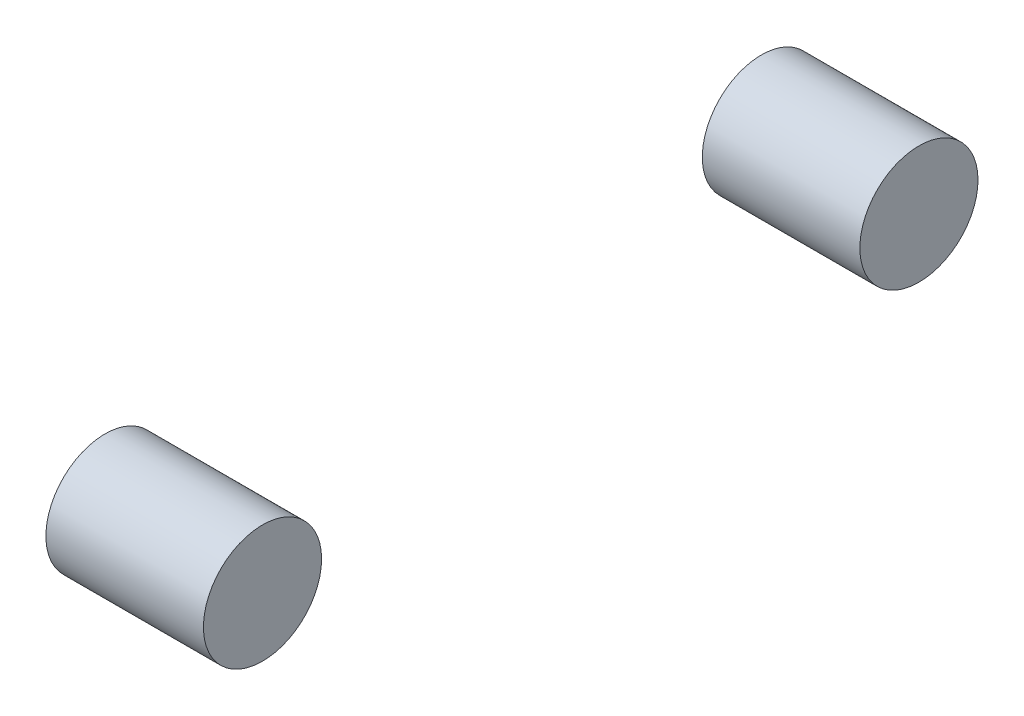
from build123d import *

# Parameters (mm, degrees)
BOSS_EXTRUDE1_START = -1117.712701274
SKETCH1_R           = 90
BOSS_EXTRUDE1_DEPTH = 240
BOSS_EXTRUDE2_START = -1117.712701274
SKETCH2_R           = 90
BOSS_EXTRUDE2_DEPTH = 240


with BuildPart() as part:
    # Sketch1 → Boss-Extrude1 (new body)
    with BuildSketch(Plane(origin=(0, 0, 0), x_dir=(0, 0, -1), z_dir=(1, 0, 0)).offset(BOSS_EXTRUDE1_START)):
        with Locations((500, -1650)):
            Circle(SKETCH1_R)
    extrude(amount=BOSS_EXTRUDE1_DEPTH)


with BuildPart() as body_2:
    # Sketch2 → Boss-Extrude2 (new body)
    with BuildSketch(Plane(origin=(0, 0, 0), x_dir=(0, 0, -1), z_dir=(1, 0, 0)).offset(BOSS_EXTRUDE2_START)):
        with Locations((-500, -1650)):
            Circle(SKETCH2_R)
    extrude(amount=BOSS_EXTRUDE2_DEPTH)


solid = Compound([part.part, body_2.part])
